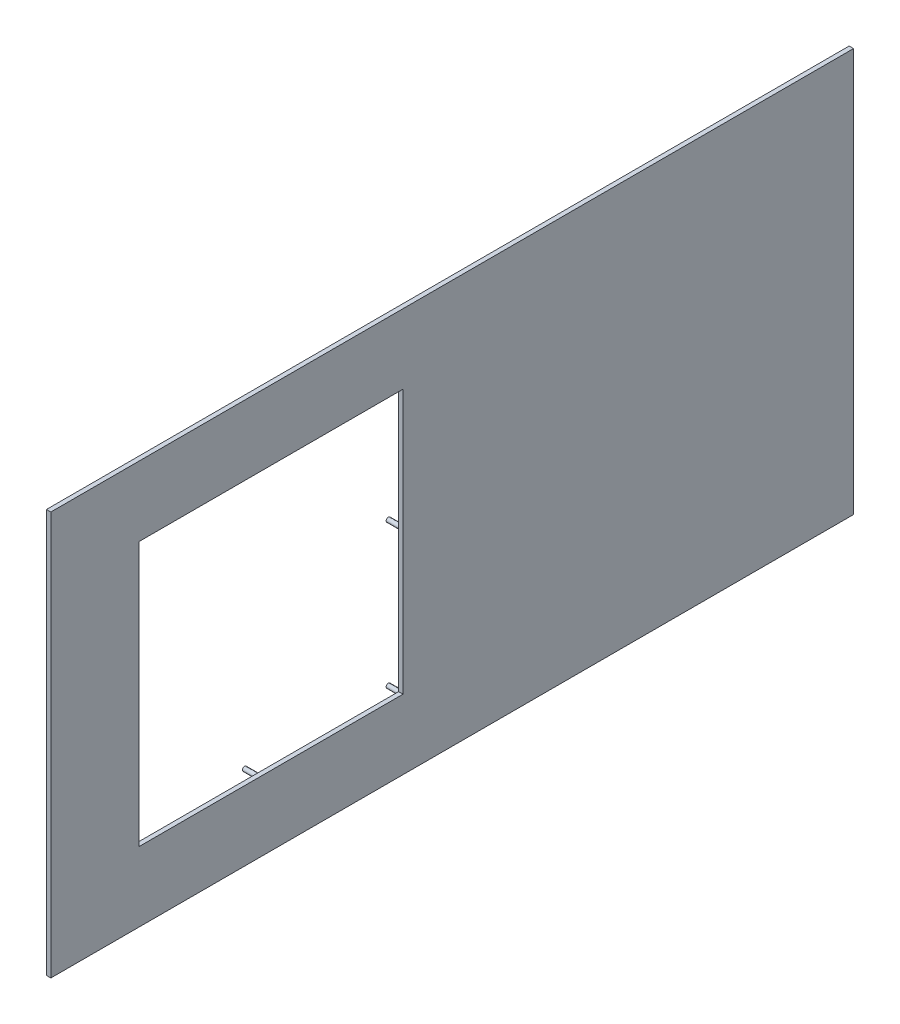
from build123d import *

# Parameters (mm, degrees)
SKETCH1_W           = 547
SKETCH1_H           = 275
BOSS_EXTRUDE1_DEPTH = 3
SKETCH2_W           = 180
SKETCH2_H           = 180
CUT_EXTRUDE1_DEPTH  = 3
SKETCH3_R           = 1.5
BOSS_EXTRUDE2_DEPTH = 15


with BuildPart() as part:
    # Sketch1 → Boss-Extrude1 (new body)
    with BuildSketch(Plane(origin=(0, 0, 0), x_dir=(0, 0, -1), z_dir=(1, 0, 0))):
        Rectangle(SKETCH1_W, SKETCH1_H)
    extrude(amount=BOSS_EXTRUDE1_DEPTH)

    # Sketch2 → Cut-Extrude1 (cut)
    with BuildSketch(Plane(origin=(3, 0, 0), x_dir=(0, 0, -1), z_dir=(1, 0, 0))):
        with Locations((-123.5, 0)):
            Rectangle(SKETCH2_W, SKETCH2_H)
    extrude(amount=-CUT_EXTRUDE1_DEPTH, mode=Mode.SUBTRACT)

    # Sketch3 → Boss-Extrude2 (add)
    with BuildSketch(Plane.ZY):
        with Locations((25.5, 98)):
            Circle(SKETCH3_R)
        with Locations((221.5, -98)):
            Circle(SKETCH3_R)
        with Locations((123.5, 98)):
            Circle(SKETCH3_R)
        with Locations((221.5, 98)):
            Circle(SKETCH3_R)
        with Locations((123.5, -98)):
            Circle(SKETCH3_R)
        with Locations((25.5, -98)):
            Circle(SKETCH3_R)
        with Locations((25.5, 0)):
            Circle(SKETCH3_R)
        with Locations((221.5, 0)):
            Circle(SKETCH3_R)
    extrude(amount=BOSS_EXTRUDE2_DEPTH)


solid = part.part
